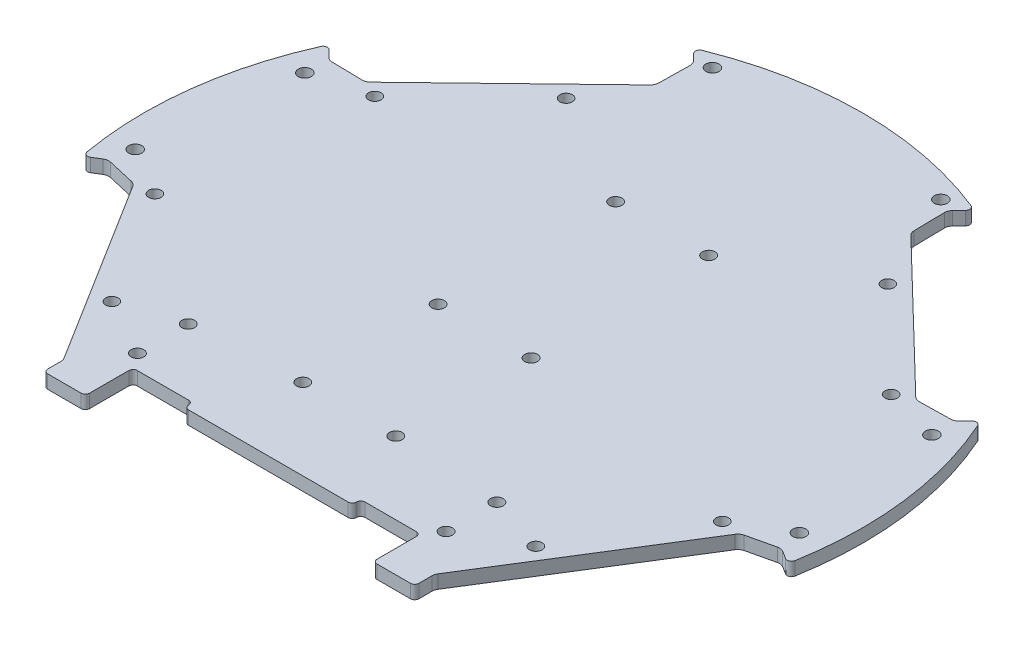
from build123d import *

# Parameters (mm, degrees)
BOSS_EXTRUDE4_DEPTH  = 1.5875
M3_CLEARANCE_HOLE3_D = 3
M3_CLEARANCE_HOLE1_D = 3.1
M3_CLEARANCE_HOLE4_D = 2.95
M3_CLEARANCE_HOLE2_D = 3.1
M3_CLEARANCE_HOLE5_D = 3
BOSS_EXTRUDE6_DEPTH  = 3.175
FILLET1_R            = 2
FILLET3_R            = 1


with BuildPart() as part:
    # Sketch1 → Boss-Extrude4 (new, symmetric)
    with BuildSketch(Plane(origin=(0, 0, 0), x_dir=(1, 0, 0), z_dir=(0, 1, 0))):
        with BuildLine():
            Line((-62.799553621, 32.496136604), (-73.969425011, 32.691107434))
            Line((-73.969425011, 32.691107434), (-77.053684287, 35.88495141))
            ThreePointArc((-77.053684287, 35.88495141), (-84.36642289, 10.358894189), (-83.446216027, -16.178041625))
            Line((-83.446216027, -16.178041625), (-79.680911643, -13.825218315))
            Line((-79.680911643, -13.825218315), (-69.484649137, -16.179210996))
            Line((-69.484649137, -16.179210996), (-43.894490772, -57.132025032))
            Line((-43.894490772, -57.132025032), (-43.894490772, -64.826600275))
            Line((-43.894490772, -64.826600275), (-43.094490772, -64.826600275))
            Line((-43.094490772, -64.826600275), (-34, -64.826600275))
            Line((-34, -64.826600275), (-34, -55.55))
            Line((-34, -55.55), (-34, -53.55))
            Line((-34, -53.55), (-20, -53.55))
            Line((-20, -53.55), (-19.718918331, -55.55))
            Line((-19.718918331, -55.55), (19.718918331, -55.55))
            Line((19.718918331, -55.55), (20, -53.55))
            Line((20, -53.55), (34, -53.55))
            Line((34, -53.55), (34, -55.55))
            Line((34, -55.55), (34, -64.826600275))
            Line((34, -64.826600275), (43.094490772, -64.826600275))
            Line((43.094490772, -64.826600275), (43.894490772, -64.826600275))
            Line((43.894490772, -64.826600275), (43.894490772, -57.132025032))
            Line((43.894490772, -57.132025032), (69.484649137, -16.179210996))
            Line((69.484649137, -16.179210996), (79.680911643, -13.825218315))
            Line((79.680911643, -13.825218315), (83.446216027, -16.178041625))
            ThreePointArc((83.446216027, -16.178041625), (84.610662337, -8.126242604), (85, 0))
            ThreePointArc((85, 0), (82.98964744, 18.377116688), (77.053684287, 35.88495141))
            Line((77.053684287, 35.88495141), (73.969425011, 32.691107434))
            Line((73.969425011, 32.691107434), (62.799553621, 32.496136604))
            Line((62.799553621, 32.496136604), (30.284668021, 63.895396642))
            Line((30.284668021, 63.895396642), (30.089697191, 75.065268032))
            Line((30.089697191, 75.065268032), (33.173956467, 78.259112008))
            ThreePointArc((33.173956467, 78.259112008), (0, 85), (-33.173956467, 78.259112008))
            Line((-33.173956467, 78.259112008), (-30.089697191, 75.065268032))
            Line((-30.089697191, 75.065268032), (-30.284668021, 63.895396642))
            Line((-30.284668021, 63.895396642), (-62.799553621, 32.496136604))
        make_face()
    extrude(amount=BOSS_EXTRUDE4_DEPTH, both=True)

    # M3 Clearance Hole3 (through all)
    with Locations(Plane(origin=(0, -1.5875, 0), x_dir=(-1, 0, 0), z_dir=(0, -1, 0))):
        with Locations((36.5, -50), (36.5, -38), (-36.5, -50), (-36.5, -38)):
            Hole(M3_CLEARANCE_HOLE3_D / 2)

    # M3 Clearance Hole1 (through all)
    with Locations(Plane(origin=(0, 1.5875, 0), x_dir=(1, 0, 0), z_dir=(0, 1, 0))):
        with Locations((-78.542321426, -8.49139241), (78.542321426, -8.49139241), (74.155025063, 27.240269049), (-74.155025063, 27.240269049)):
            Hole(M3_CLEARANCE_HOLE1_D / 2)

    # M3 Clearance Hole4 (through all)
    with Locations(Plane(origin=(0, -1.5875, 0), x_dir=(-1, 0, 0), z_dir=(0, -1, 0))):
        with Locations((-67.099301622, -15.278865202), (-50.141885166, -42.416404279), (-61.062544382, 30.698137949), (-38.043670771, 52.927205804), (50.141885166, -42.416404279), (67.099301622, -15.278865202), (38.043670771, 52.927205804), (61.062544382, 30.698137949)):
            Hole(M3_CLEARANCE_HOLE4_D / 2)

    # M3 Clearance Hole2 (through all)
    with Locations(Plane(origin=(0, 1.5875, 0), x_dir=(1, 0, 0), z_dir=(0, 1, 0))):
        with Locations((27, 76.497766718), (-27, 76.497766718)):
            Hole(M3_CLEARANCE_HOLE2_D / 2)

    # M3 Clearance Hole5 (through all)
    with Locations(Plane(origin=(0, 1.5875, 0), x_dir=(1, 0, 0), z_dir=(0, 1, 0))):
        with Locations((-11, -4.4), (11, -4.4), (11, -36.4), (-11, -36.4), (-11, 37.6), (11, 37.6)):
            Hole(M3_CLEARANCE_HOLE5_D / 2)

    # Sketch22 → Boss-Extrude6 (add)
    with BuildSketch(Plane(origin=(0, 1.5875, 0), x_dir=(1, 0, 0), z_dir=(0, 1, 0))):
        Polygon((65.061950694, 32.535626892), (30.245177733, 66.157793715), (30.284668021, 63.895396642), (62.799553621, 32.496136604), align=None)
        Polygon((-30.284668021, 63.895396642), (-30.245177733, 66.157793715), (-65.061950694, 32.535626892), (-62.799553621, 32.496136604), align=None)
        Polygon((43.894490772, -60.151352895), (71.689396914, -15.670204865), (69.484649137, -16.179210996), (43.894490772, -57.132025032), align=None)
        Polygon((-69.484649137, -16.179210996), (-71.689396914, -15.670204865), (-43.894490772, -60.151352895), (-43.894490772, -57.132025032), align=None)
    extrude(amount=-BOSS_EXTRUDE6_DEPTH)

    # Fillet1
    fillet1_edges = [part.edges().sort_by_distance(p)[0] for p in [
        (-30.245177733, -0.79375, -66.157793715),
        (-65.061950694, -0.79375, -32.535626892),
        (-71.689396914, 0.79375, 15.670204865),
        (-43.894490772, 0.79375, 60.151352895),
        (43.894490772, -0.79375, 60.151352895),
        (71.689396914, -0.79375, 15.670204865),
        (65.061950694, -0.79375, -32.535626892),
        (30.245177733, 0.79375, -66.157793715),
        (30.089697191, -0.79375, -75.065268032),
        (73.969425011, -0.79375, -32.691107434),
        (79.680911643, -0.79375, 13.825218315),
        (-79.680911643, -0.79375, 13.825218315),
        (-73.969425011, -0.79375, -32.691107434),
        (-30.089697191, -0.79375, -75.065268032),
    ]]
    fillet(fillet1_edges, radius=FILLET1_R)

    # Fillet3
    fillet3_edges = [part.edges().sort_by_distance(p)[0] for p in [
        (33.173956467, -0.79375, -78.259112008),
        (77.053684287, 0.79375, -35.88495141),
        (83.446216027, -0.79375, 16.178041625),
        (43.894490772, -0.79375, 64.826600275),
        (34, 0.79375, 64.826600275),
        (34, -0.79375, 53.55),
        (20, -0.79375, 53.55),
        (19.718918331, 0.79375, 55.55),
        (-19.718918331, 0.79375, 55.55),
        (-20, -0.79375, 53.55),
        (-34, -0.79375, 53.55),
        (-34, 0.79375, 64.826600275),
        (-43.894490772, -0.79375, 64.826600275),
        (-83.446216027, -0.79375, 16.178041625),
        (-77.053684287, -0.79375, -35.88495141),
        (-33.173956467, -0.79375, -78.259112008),
    ]]
    fillet(fillet3_edges, radius=FILLET3_R)


solid = part.part
